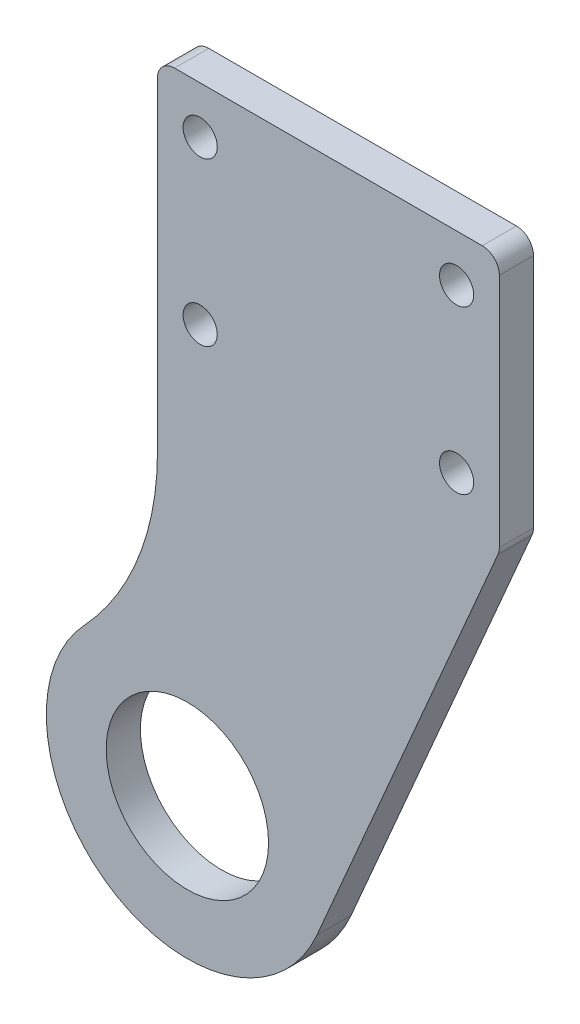
from build123d import *
from build123d.topology import SkipClean

# Parameters (mm, degrees)
SKETCH_1_R          = 9.5
EXTRUDE_1_DEPTH     = 4
SKETCH_2_W          = 20
SKETCH_2_H          = 30
EXTRUDE_2_DEPTH     = 4
CUT_EXTRUDE_START   = -4
CUT_EXTRUDE_1_DEPTH = 4
EXTRUDE_3_DEPTH     = 4
CUT_EXTRUDE_2_DEPTH = 4
SKETCH_6_R          = 2
CUT_EXTRUDE_3_DEPTH = 4
FILLET_1_R          = 2


with BuildPart() as part:
    # 草图1 → 凸台-拉伸1 (new body)
    with BuildSketch(Plane.XY):
        with BuildLine():
            Line((-16.5, 0), (-16.5, 73))
            Line((-16.5, 73), (16.5, 73))
            Line((16.5, 73), (16.5, 0))
            ThreePointArc((16.5, 0), (0, -16.5), (-16.5, 0))
        make_face()
        Circle(SKETCH_1_R, mode=Mode.SUBTRACT)
    extrude(amount=EXTRUDE_1_DEPTH)

    # 草图2 → 凸台-拉伸2 (add)
    with BuildSketch(Plane.XY.offset(4)):
        with Locations((26.5, 58)):
            Rectangle(SKETCH_2_W, SKETCH_2_H)
    extrude(amount=-EXTRUDE_2_DEPTH)

    # 草图3 → 切除-拉伸1 (cut)
    with BuildSketch(Plane.XY.offset(4).offset(CUT_EXTRUDE_START)):
        with BuildLine():
            Line((-15.707266889, 5.052896881), (-3.5, 43))
            Line((-3.5, 43), (-3.5, 73))
            Line((-3.5, 73), (-16.5, 73))
            Line((-16.5, 73), (-16.5, 0))
            ThreePointArc((-16.5, 0), (-16.300612008, 2.557351788), (-15.707266889, 5.052896881))
        make_face()
    extrude(amount=CUT_EXTRUDE_1_DEPTH, mode=Mode.SUBTRACT)

    # 草图4 → 凸台-拉伸3 (add)
    with BuildSketch(Plane(origin=(0, 0, 0), x_dir=(-1, 0, 0), z_dir=(0, 0, -1))):
        Polygon((-36.5, 43), (-15.152569354, -6.530669335), (-9.5, 0), (-16.5, 43), align=None)
    extrude(amount=-EXTRUDE_3_DEPTH)

    # 草图5 → 切除-拉伸2 (cut)
    with SkipClean():  # the faces are left unmerged after this step: merging them gives an invalid solid
        with BuildSketch(Plane.XY.offset(4).offset(CUT_EXTRUDE_START)):
            with BuildLine():
                Line((-3.5, 43), (-3.5, 33))
                ThreePointArc((-3.5, 33), (-5.718901629, 21.313506702), (-12.066772655, 11.253577107))
                ThreePointArc((-12.066772655, 11.253577107), (-14.228894088, 8.353955533), (-15.707266889, 5.052896881))
                Line((-15.707266889, 5.052896881), (-3.5, 43))
            make_face()
        extrude(amount=CUT_EXTRUDE_2_DEPTH, mode=Mode.SUBTRACT)

    # 草图6 → 切除-拉伸3 (cut)
    with SkipClean():  # the faces are left unmerged after this step: merging them gives an invalid solid
        with BuildSketch(Plane(origin=(0, 0, 0), x_dir=(-1, 0, 0), z_dir=(0, 0, -1))):
            with Locations((-31.5, 67.5)):
                Circle(SKETCH_6_R)
            with Locations((-1.5, 67.5)):
                Circle(SKETCH_6_R)
            with Locations((-31.5, 48.5)):
                Circle(SKETCH_6_R)
            with Locations((-1.5, 48.5)):
                Circle(SKETCH_6_R)
        extrude(amount=-CUT_EXTRUDE_3_DEPTH, mode=Mode.SUBTRACT)

    # 圆角1
    fillet_1_edges = [part.edges().sort_by_distance(p)[0] for p in [
        (36.5, 73, 2),
        (36.5, 43, 2),
        (-3.5, 73, 2),
    ]]
    fillet(fillet_1_edges, radius=FILLET_1_R)


solid = part.part
